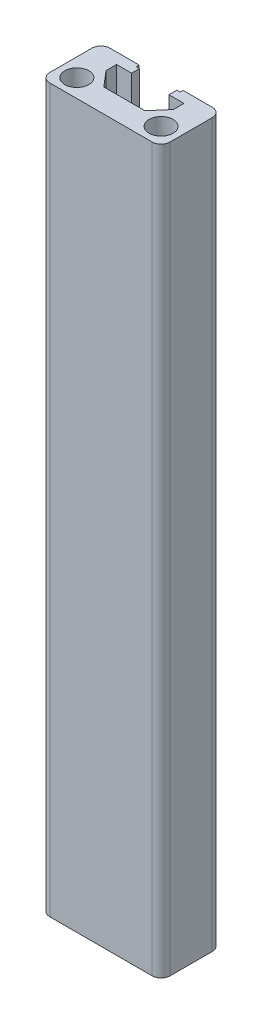
from build123d import *

# Parameters (mm, degrees)
SKETCH_1_R      = 2
EXTRUDE_1_DEPTH = 120
FILLET_1_R      = 1.5


with BuildPart() as part:
    # 草图1 → 凸台-拉伸1 (new body)
    with BuildSketch(Plane(origin=(0, 0, 0), x_dir=(1, 0, 0), z_dir=(0, 1, 0))):
        Polygon((0, 0), (20, 0), (20, 10), (13.65, 10), (13.65, 9.510427602), (13.1, 9.510427602), (13.1, 8.2), (15.6, 8.2), (15.6, 6.447507136), (13.412706863, 3.9), (6.587293137, 3.9), (4.4, 6.447507136), (4.4, 8.2), (6.9, 8.2), (6.9, 9.510427602), (6.35, 9.510427602), (6.35, 10), (0, 10), align=None)
        with Locations(Location((3, 3, 0), (0, 0, 270))):
            Circle(SKETCH_1_R, mode=Mode.SUBTRACT)
        with Locations(Location((17, 3, 0), (0, 0, 270))):
            Circle(SKETCH_1_R, mode=Mode.SUBTRACT)
    extrude(amount=EXTRUDE_1_DEPTH)

    # 圆角1
    fillet_1_edges = [part.edges().sort_by_distance(p)[0] for p in [
        (0, 60, -10),
        (20, 60, -10),
        (20, 60, 0),
        (0, 60, 0),
    ]]
    fillet(fillet_1_edges, radius=FILLET_1_R)


solid = part.part
